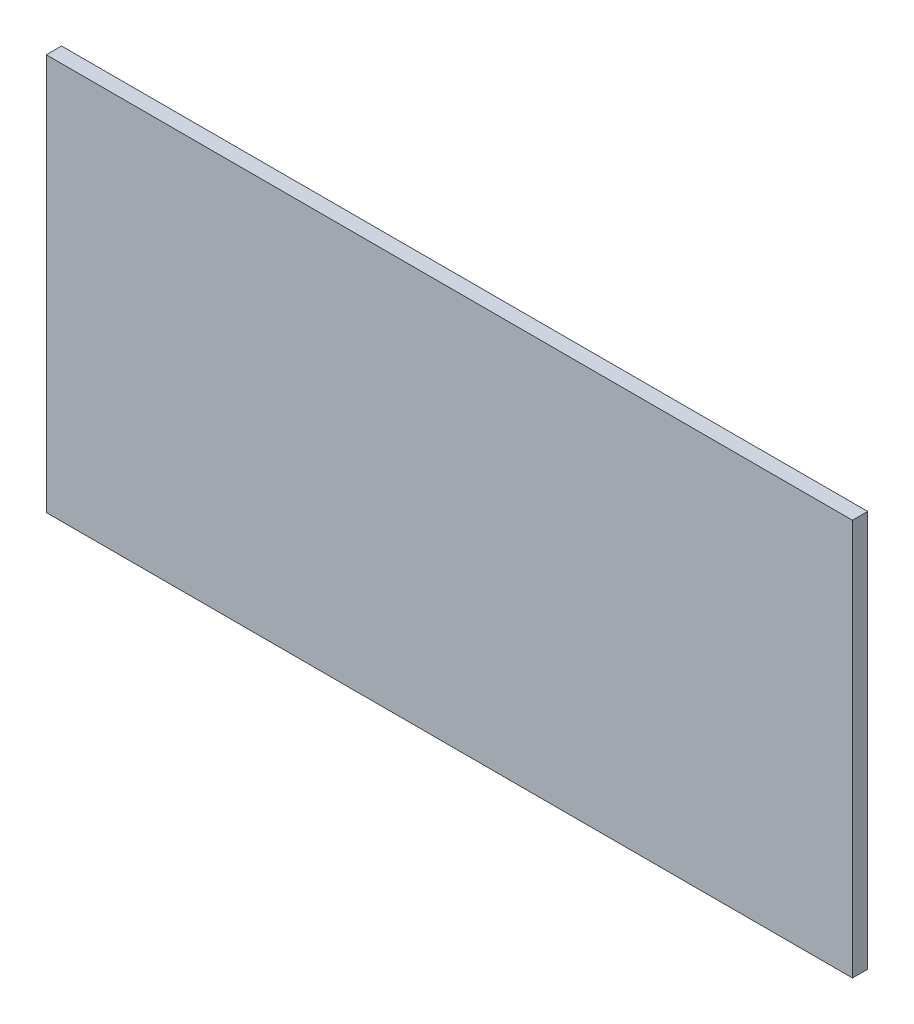
from build123d import *

# Parameters (mm, degrees)
SKETCH1_W           = 671.5125
SKETCH1_H           = 330.2
BOSS_EXTRUDE1_DEPTH = 12.7


with BuildPart() as part:
    # Sketch1 → Boss-Extrude1 (new body)
    with BuildSketch(Plane.XY):
        Rectangle(SKETCH1_W, SKETCH1_H)
    extrude(amount=BOSS_EXTRUDE1_DEPTH)


solid = part.part
